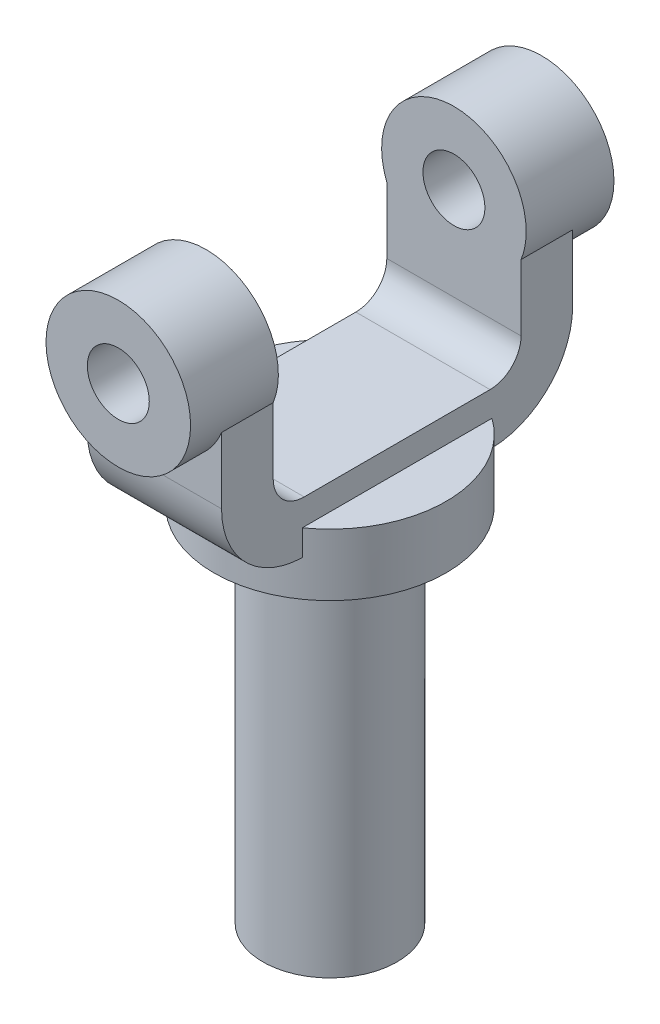
from build123d import *

# Parameters (mm, degrees)
BOSS_EXTRUDE1_DEPTH     = 13
SKETCH3_R               = 14
SKETCH3_R_2             = 6
BOSS_EXTRUDE2_DEPTH     = 17
CUT_EXTRUDE1_DEPTH      = 114.3809949
CUT_EXTRUDE1_DEPTH_BACK = 114.3809949
SKETCH4_R               = 6
FILLET1_R               = 2


with BuildPart() as part:
    # Sketch1 → Revolve1 (revolve)
    with BuildSketch(Plane.XY, mode=Mode.PRIVATE) as revolve1_sk:
        Polygon((0, 0), (22.5, 0), (22.5, -12), (13, -12), (13, -82), (0, -82), align=None)
    revolve(revolve1_sk.sketch.rotate(Axis((0, 0, 0), (0, 1, 0)), 90), axis=Axis((0, 0, 0), (0, 1, 0)))

    # Sketch2 → Boss-Extrude1 (add, symmetric)
    with BuildSketch(Plane(origin=(0, 0, 0), x_dir=(0, 0, -1), z_dir=(1, 0, 0))):
        with BuildLine():
            Line((-18, 5), (18, 5))
            ThreePointArc((18, 5), (22.242640687, 6.757359313), (24, 11))
            Line((24, 11), (24, 29))
            Line((24, 29), (34, 29))
            Line((34, 29), (34, 11))
            ThreePointArc((34, 11), (29.313708499, -0.313708499), (18, -5))
            Line((18, -5), (-18, -5))
            ThreePointArc((-18, -5), (-29.313708499, -0.313708499), (-34, 11))
            Line((-34, 11), (-34, 29))
            Line((-34, 29), (-24, 29))
            Line((-24, 29), (-24, 11))
            ThreePointArc((-24, 11), (-22.242640687, 6.757359313), (-18, 5))
        make_face()
    extrude(amount=BOSS_EXTRUDE1_DEPTH, both=True)

    # Sketch3 → Boss-Extrude2 (add)
    with BuildSketch(Plane.XY.offset(-24)):
        with Locations((0, 29.004149407)):
            Circle(SKETCH3_R)
        with Locations((0, 29.004149407)):
            Circle(SKETCH3_R_2, mode=Mode.SUBTRACT)
    boss_extrude2 = extrude(amount=-BOSS_EXTRUDE2_DEPTH)

    # Mirror1: Boss-Extrude2 across plane
    add(boss_extrude2.mirror(Plane.XY))

    # Sketch4 → Cut-Extrude1 (cut, two sides: drawn at the far end of the back side and taken through both)
    with BuildSketch(Plane(origin=(0, 0, -34), x_dir=(-1, 0, 0), z_dir=(0, 0, -1)).offset(-CUT_EXTRUDE1_DEPTH_BACK)):
        with Locations(Location((0, 29.004149407, 0), (0, 0, 180))):
            Circle(SKETCH4_R)
    extrude(amount=CUT_EXTRUDE1_DEPTH + CUT_EXTRUDE1_DEPTH_BACK, mode=Mode.SUBTRACT)

    # Fillet1
    fillet1_edges = [part.edges().sort_by_distance(p)[0] for p in [
        (0, -12, 13),
    ]]
    fillet(fillet1_edges, radius=FILLET1_R)


solid = part.part
